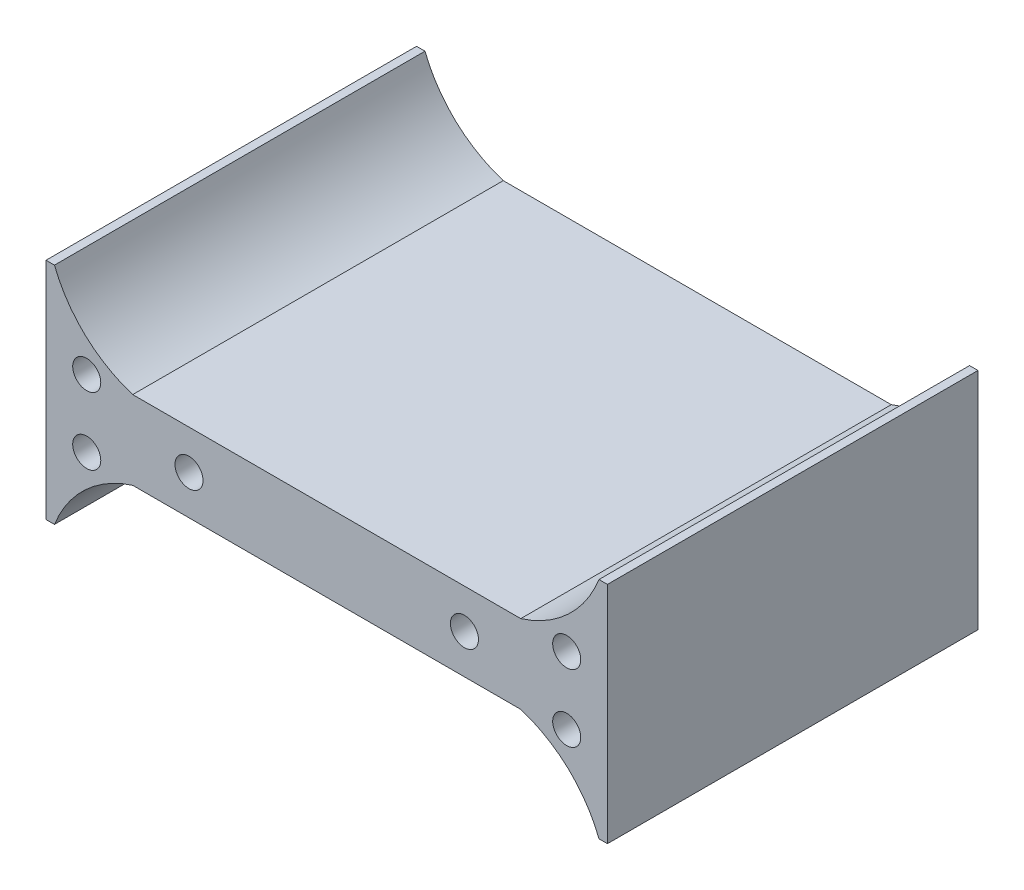
from build123d import *

# Parameters (mm, degrees)
SKETCH_3_W          = 50
SKETCH_3_H          = 7
EXTRUDE_1_DEPTH     = 33
EXTRUDE_2_DEPTH     = 33
SKETCH_5_R          = 1.25
CUT_EXTRUDE_1_DEPTH = 8
SKETCH_6_W          = 50
SKETCH_6_H          = 4
CUT_EXTRUDE_2_DEPTH = 40
CUT_EXTRUDE_START   = -8
SKETCH_7_R          = 1.25
CUT_EXTRUDE_3_DEPTH = 8


with BuildPart() as part:
    # 草图3 → 凸台-拉伸1 (new body)
    with BuildSketch(Plane.XY):
        with Locations((25, 25)):
            Rectangle(SKETCH_3_W, SKETCH_3_H)
    extrude(amount=EXTRUDE_1_DEPTH)

    # 草图4 → 凸台-拉伸2 (add)
    with BuildSketch(Plane(origin=(0, 0, 0), x_dir=(-1, 0, 0), z_dir=(0, 0, -1))):
        with BuildLine():
            Line((-50, 21.5), (-50, 11))
            ThreePointArc((-50, 11), (-47.86188219, 17.51667431), (-42.278719262, 21.5))
            Line((-42.278719262, 21.5), (-50, 21.5))
        make_face()
        with BuildLine():
            Line((-7.721280738, 21.5), (0, 21.5))
            Line((0, 21.5), (0, 11))
            ThreePointArc((0, 11), (-2.13811781, 17.51667431), (-7.721280738, 21.5))
        make_face()
        with BuildLine():
            Line((0, 28.5), (0, 39))
            ThreePointArc((0, 39), (-2.13811781, 32.48332569), (-7.721280738, 28.5))
            Line((-7.721280738, 28.5), (0, 28.5))
        make_face()
        with BuildLine():
            Line((-50, 28.5), (-42.278719262, 28.5))
            ThreePointArc((-42.278719262, 28.5), (-47.86188219, 32.48332569), (-50, 39))
            Line((-50, 39), (-50, 28.5))
        make_face()
    extrude(amount=-EXTRUDE_2_DEPTH)

    # 草图5 → 切除-拉伸1 (cut)
    with BuildSketch(Plane(origin=(0, 0, 0), x_dir=(-1, 0, 0), z_dir=(0, 0, -1))):
        with Locations((-46.372516673, 28)):
            Circle(SKETCH_5_R)
        with Locations((-46.372516673, 22)):
            Circle(SKETCH_5_R)
        with Locations((-37.264513071, 25)):
            Circle(SKETCH_5_R)
        with Locations(Location((-3.627483327, 22, 0), (0, 0, 180))):
            Circle(SKETCH_5_R)
        with Locations(Location((-3.627483327, 28, 0), (0, 0, 180))):
            Circle(SKETCH_5_R)
        with Locations(Location((-12.735486929, 25, 0), (0, 0, 180))):
            Circle(SKETCH_5_R)
    extrude(amount=-CUT_EXTRUDE_1_DEPTH, mode=Mode.SUBTRACT)

    # 草图6 → 切除-拉伸2 (cut)
    with BuildSketch(Plane(origin=(0, 0, 0), x_dir=(-1, 0, 0), z_dir=(0, 0, -1))):
        with Locations((-25, 37)):
            Rectangle(SKETCH_6_W, SKETCH_6_H)
        with Locations((-25, 13)):
            Rectangle(SKETCH_6_W, SKETCH_6_H)
    extrude(amount=-CUT_EXTRUDE_2_DEPTH, mode=Mode.SUBTRACT)

    # 草图7 → 切除-拉伸3 (cut)
    with BuildSketch(Plane.XY.offset(33).offset(CUT_EXTRUDE_START)):
        with Locations((3.627483327, 28)):
            Circle(SKETCH_7_R)
        with Locations((3.627483327, 22)):
            Circle(SKETCH_7_R)
        with Locations((12.735486929, 25)):
            Circle(SKETCH_7_R)
        with Locations(Location((46.372516673, 22, 0), (0, 0, 180))):
            Circle(SKETCH_7_R)
        with Locations(Location((46.372516673, 28, 0), (0, 0, 180))):
            Circle(SKETCH_7_R)
        with Locations(Location((37.264513071, 25, 0), (0, 0, 180))):
            Circle(SKETCH_7_R)
    extrude(amount=CUT_EXTRUDE_3_DEPTH, mode=Mode.SUBTRACT)


solid = part.part
